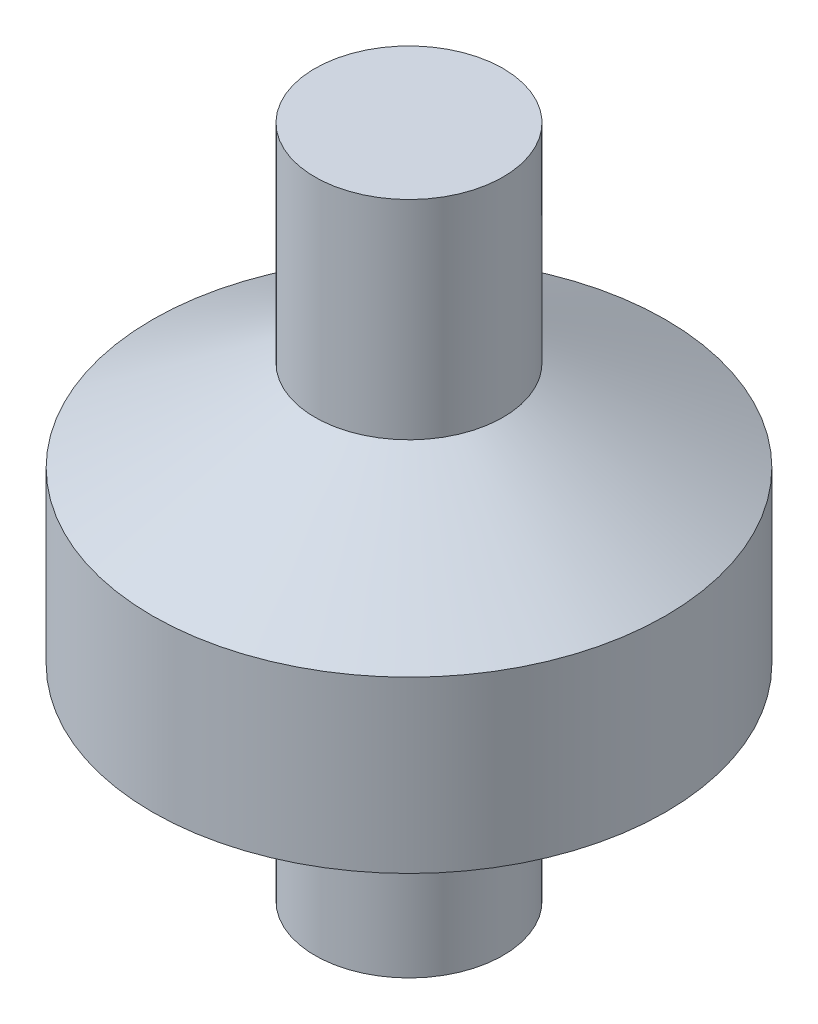
from build123d import *


with BuildPart() as part:
    # Croquis1 → Revolución1 (revolve)
    with BuildSketch(Plane.XY, mode=Mode.PRIVATE) as revoluci_n1_sk:
        Polygon((0, 12.166546105), (11, 12.166546105), (11, -12.166546105), (30, -22.766330184), (30, -42.640069676), (20.916728677, -42.640069676), (20.916728677, -45.750741945), (11, -45.750741945), (11, -66.658131909), (0, -66.658131909), align=None)
    revolve(revoluci_n1_sk.sketch.rotate(Axis((0, -66.658131909, 0), (0, 1, 0)), 90), axis=Axis((0, -66.658131909, 0), (0, 1, 0)))


solid = part.part
